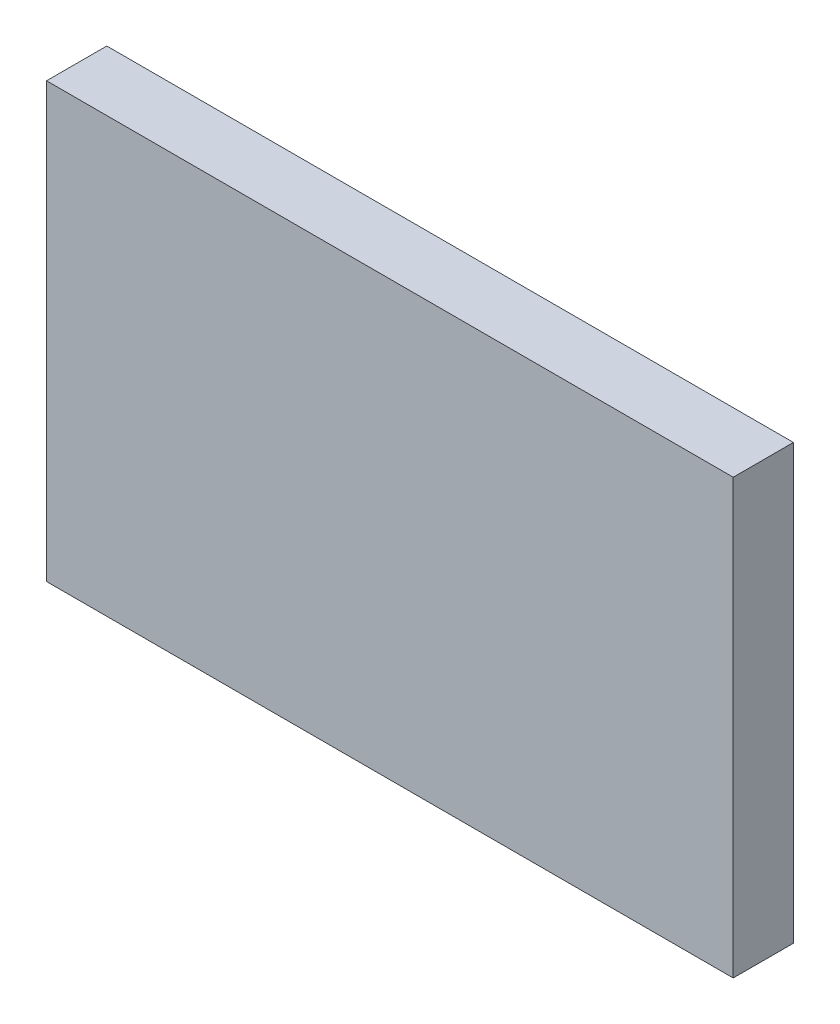
from build123d import *

# Parameters (mm, degrees)
SKETCH1_W           = 57
SKETCH1_H           = 36
BOSS_EXTRUDE1_DEPTH = 5


with BuildPart() as part:
    # Sketch1 → Boss-Extrude1 (new body)
    with BuildSketch(Plane.XY):
        with Locations((28.5, 18)):
            Rectangle(SKETCH1_W, SKETCH1_H)
    extrude(amount=BOSS_EXTRUDE1_DEPTH)


solid = part.part
